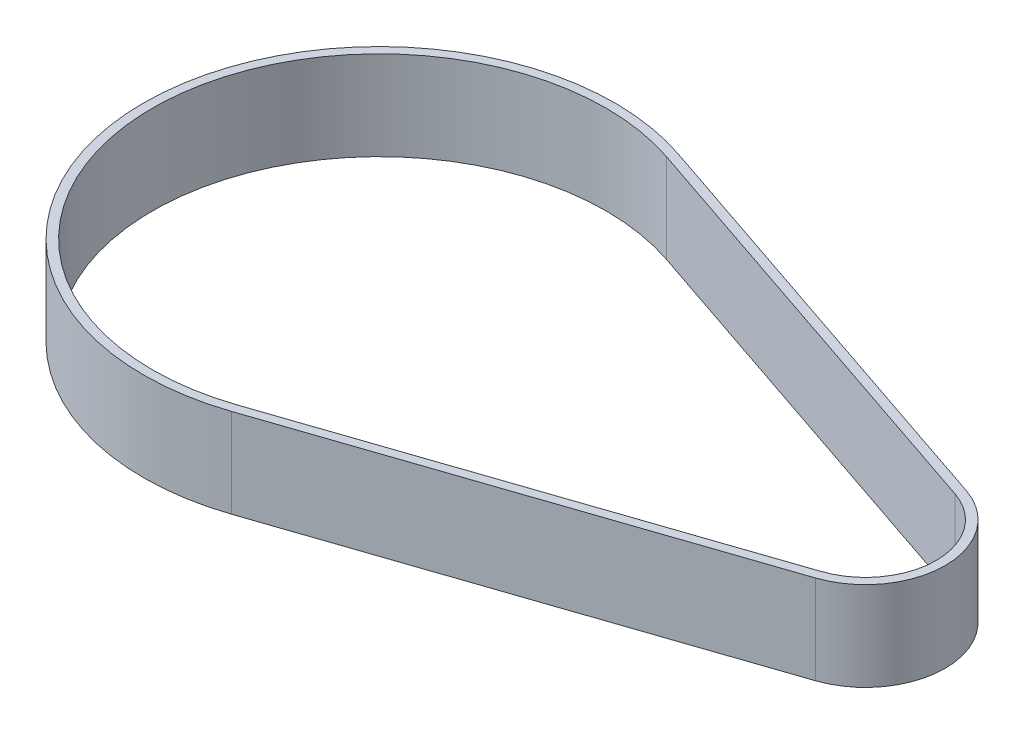
from build123d import *

# Parameters (mm, degrees)
SALIENTE_EXTRUIR1_DEPTH = 5


with BuildPart() as part:
    # Croquis1 → Saliente-Extruir1 (new, symmetric)
    with BuildSketch(Plane(origin=(0, 0, 0), x_dir=(-1, 0, 0), z_dir=(0, 1, 0))):
        with BuildLine():
            Line((-2.871048535, 8.477003026), (46.110357601, 25.066355877))
            ThreePointArc((46.110357601, 25.066355877), (81.065, 0), (46.110357601, -25.066355877))
            Line((46.110357601, -25.066355877), (-2.871048535, -8.477003026))
            ThreePointArc((-2.871048535, -8.477003026), (-8.95, 0), (-2.871048535, 8.477003026))
        make_face()
        with BuildLine():
            Line((-2.550260989, 7.52985185), (46.431145147, 24.1192047))
            ThreePointArc((46.431145147, 24.1192047), (80.065, 0), (46.431145147, -24.1192047))
            Line((46.431145147, -24.1192047), (-2.550260989, -7.52985185))
            ThreePointArc((-2.550260989, -7.52985185), (-7.95, 0), (-2.550260989, 7.52985185))
        make_face(mode=Mode.SUBTRACT)
    extrude(amount=SALIENTE_EXTRUIR1_DEPTH, both=True)


solid = part.part
